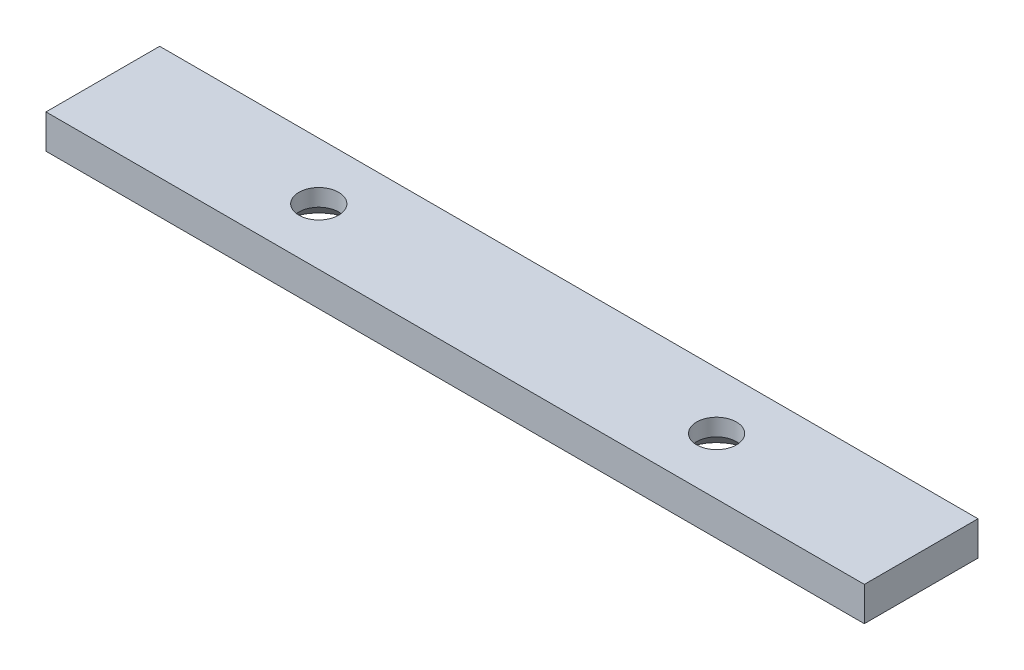
from build123d import *

# Parameters (mm, degrees)
SKETCH1_W           = 144
SKETCH1_H           = 20
BOSS_EXTRUDE1_DEPTH = 6
LPATTERN1_COUNT     = 2
LPATTERN1_PITCH     = 70


with BuildPart() as part:
    # Sketch1 → Boss-Extrude1 (new body)
    with BuildSketch(Plane(origin=(0, 0, 0), x_dir=(1, 0, 0), z_dir=(0, 1, 0))):
        Rectangle(SKETCH1_W, SKETCH1_H)
    extrude(amount=BOSS_EXTRUDE1_DEPTH)

    # Sketch5 → CSK for M2 Flat Head Machine Screw1 (revolve, cut)
    with BuildSketch(Plane(origin=(-34, 0, 0), x_dir=(0, 0, -1), z_dir=(1, 0, 0))):
        Polygon((0, 0), (0, 6), (3.5, 6), (3.5, 3), (6.5, 0), align=None)
    csk_for_m2_flat_head_machine_screw1 = revolve(axis=Axis((-34, -6.35, 0), (0, 1, 0)), mode=Mode.SUBTRACT)

    # LPattern1: CSK for M2 Flat Head Machine Screw1 ×2
    with Locations(*[(i * LPATTERN1_PITCH, 0, 0) for i in range(1, LPATTERN1_COUNT)]):
        add(csk_for_m2_flat_head_machine_screw1, mode=Mode.SUBTRACT)


solid = part.part
